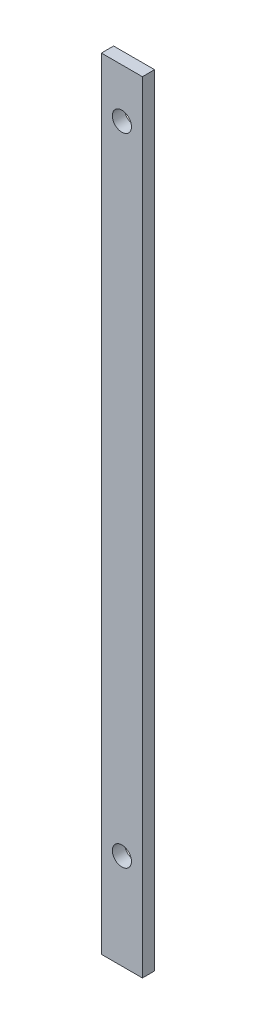
from build123d import *

# Parameters (mm, degrees)
SKETCH1_W              = 10.668
SKETCH1_H              = 203.2
BOSS_EXTRUDE1_DEPTH    = 3.175
F_10_CLEARANCE_HOLE1_D = 4.9784
F_10_CLEARANCE_HOLE2_D = 4.9784


with BuildPart() as part:
    # Sketch1 → Boss-Extrude1 (new body)
    with BuildSketch(Plane.XY):
        with Locations((-13.716, 0)):
            Rectangle(SKETCH1_W, SKETCH1_H)
    extrude(amount=BOSS_EXTRUDE1_DEPTH)

    # #10 Clearance Hole1 (through all)
    with Locations(Plane.XY.offset(3.175)):
        with Locations((-13.716, -76.754256991)):
            Hole(F_10_CLEARANCE_HOLE1_D / 2)

    # #10 Clearance Hole2 (through all)
    with Locations(Plane.XY.offset(3.175)):
        with Locations((-13.716, 88.9)):
            Hole(F_10_CLEARANCE_HOLE2_D / 2)


solid = part.part
